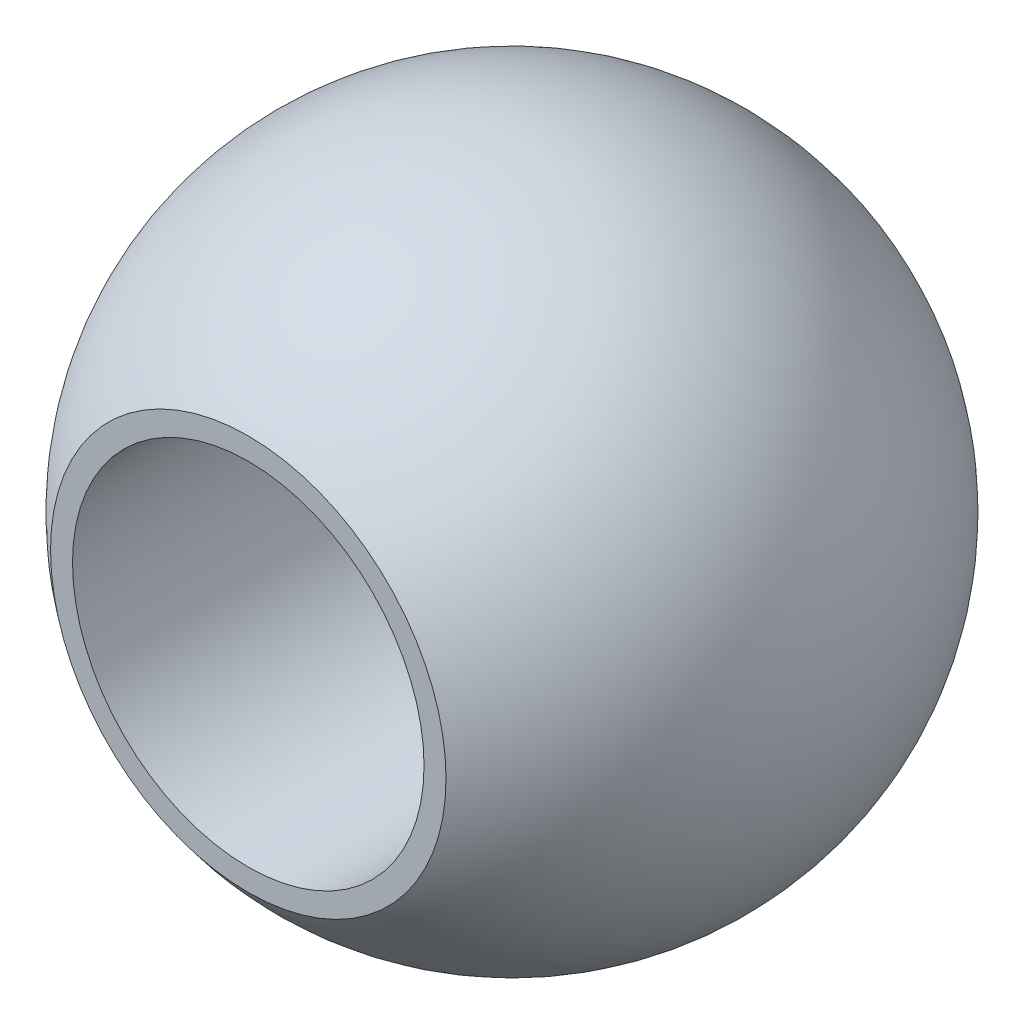
from build123d import *


with BuildPart() as part:
    # Эскиз1 → Повернуть1 (revolve)
    with BuildSketch(Plane(origin=(0, 0, 0), x_dir=(1, 0, 0), z_dir=(0, 1, 0))):
        with BuildLine():
            Line((4, 6), (4, -6))
            Line((4, -6), (4.5, -6))
            ThreePointArc((4.5, -6), (7.5, 0), (4.5, 6))
            Line((4.5, 6), (4, 6))
        make_face()
    revolve(axis=Axis((0, 0, -7.5), (0, 0, 1)))


solid = part.part
